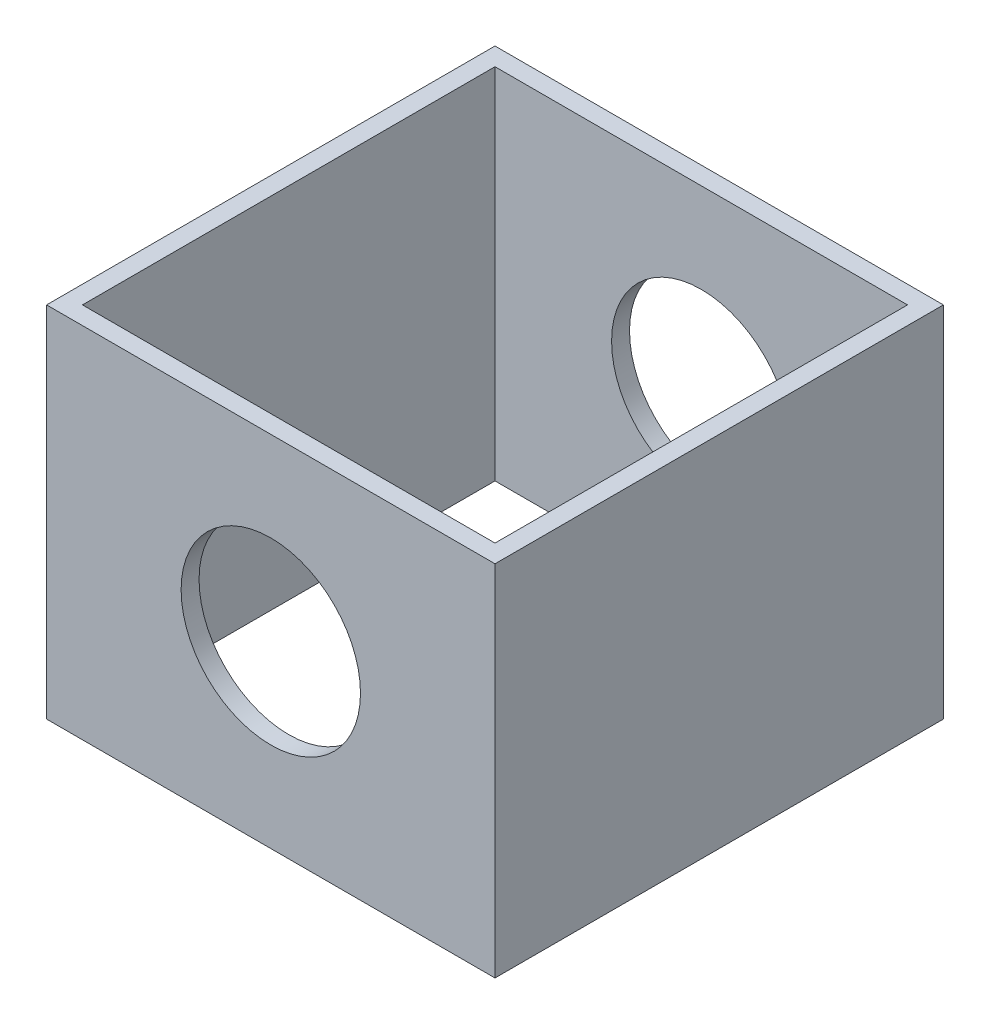
from build123d import *

# Parameters (mm, degrees)
SKETCH1_W           = 31.75
SKETCH1_H           = 31.75
SKETCH1_W_2         = 29.21
SKETCH1_H_2         = 29.21
BOSS_EXTRUDE1_DEPTH = 25.4
CUT_EXTRUDE1_REACH  = 52.816
SKETCH2_R           = 6.35


with BuildPart() as part:
    # Sketch1 → Boss-Extrude1 (new body)
    with BuildSketch(Plane(origin=(0, 0, 0), x_dir=(1, 0, 0), z_dir=(0, 1, 0))):
        with Locations((-14.605, 14.605)):
            Rectangle(SKETCH1_W, SKETCH1_H)
        with Locations((-14.605, 14.605)):
            Rectangle(SKETCH1_W_2, SKETCH1_H_2, mode=Mode.SUBTRACT)
    extrude(amount=BOSS_EXTRUDE1_DEPTH)

    # Cut-Extrude1: up to this face of the body (flat: up to its plane)
    cut_extrude1_end = Plane(part.part.faces().sort_by_distance((-14.605, 12.7, -30.48))[0])
    # Sketch2 → Cut-Extrude1 (cut, up to the picked face)
    with BuildSketch(Plane.XY.offset(1.27), mode=Mode.PRIVATE) as cut_extrude1_sk1:
        with Locations((-14.605, 12.7)):
            Circle(SKETCH2_R)
    cut_extrude1_tool1 = split(extrude(cut_extrude1_sk1.sketch, amount=-CUT_EXTRUDE1_REACH, mode=Mode.PRIVATE), bisect_by=cut_extrude1_end, keep=Keep.BOTH, mode=Mode.PRIVATE)
    add(cut_extrude1_tool1.solids().sort_by(Axis((-14.605, 12.7, 1.27), (0, 0, -1)))[0], mode=Mode.SUBTRACT)


solid = part.part
